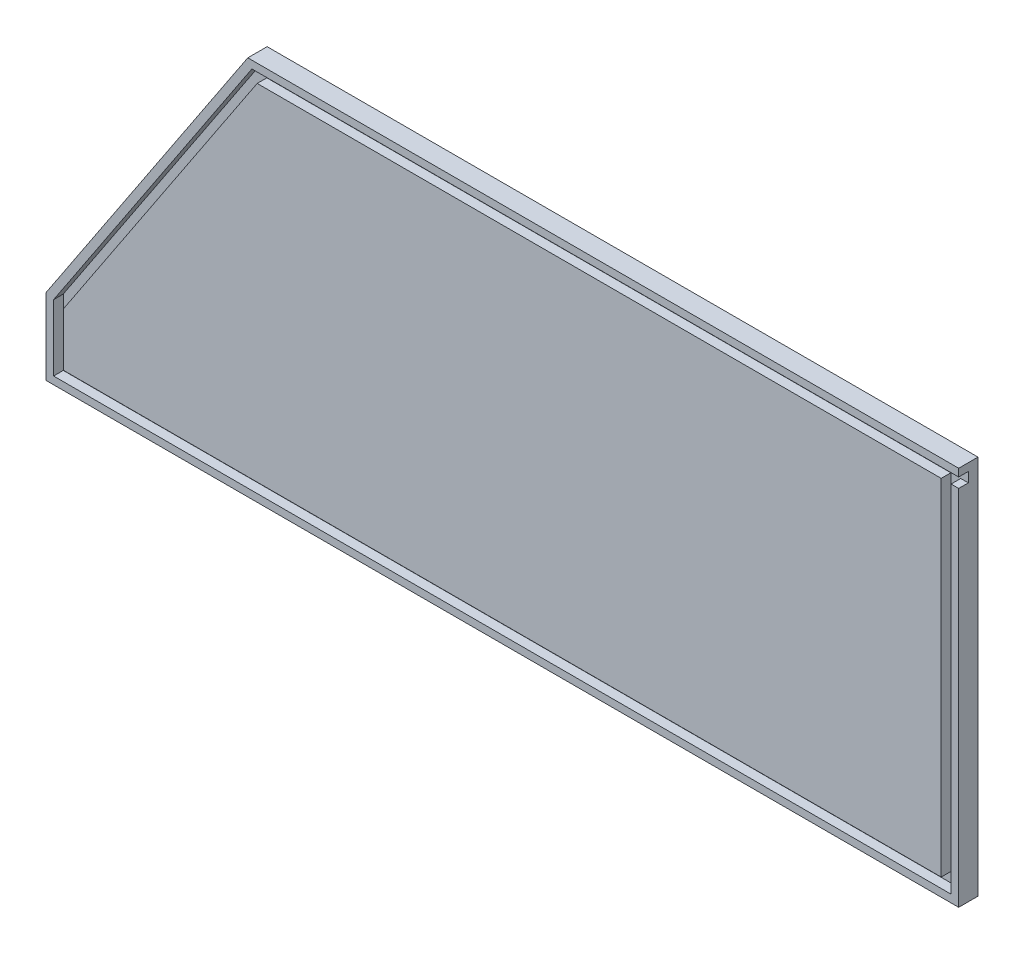
from build123d import *

# Parameters (mm, degrees)
BOSS_EXTRUDE1_DEPTH = 12.7
CUT_EXTRUDE1_DEPTH  = 6.35
SKETCH5_W           = 41.48623644
SKETCH5_H           = 6.5
CUT_EXTRUDE2_DEPTH  = 6.35


with BuildPart() as part:
    # Sketch1 → Boss-Extrude1 (new body)
    with BuildSketch(Plane.XY):
        Polygon((-524.529885057, -25.691954023), (75.470114943, -25.691954023), (75.470114943, 224.308045977), (-391.864893443, 224.308045977), (-524.529885057, 24.308045977), align=None)
    extrude(amount=BOSS_EXTRUDE1_DEPTH)

    # Sketch4 → Cut-Extrude1 (cut)
    with BuildSketch(Plane.XY.offset(12.7)):
        Polygon((-519.529885057, 22.800489254), (-519.529885057, -20.691954023), (70.470114943, -20.691954023), (70.470114943, 219.308045977), (-389.181518234, 219.308045977), align=None)
        Polygon((-513.029885057, 20.840665514), (-513.029885057, -14.191954023), (63.970114943, -14.191954023), (63.970114943, 212.808045977), (-385.693130461, 212.808045977), align=None, mode=Mode.SUBTRACT)
    extrude(amount=-CUT_EXTRUDE1_DEPTH, mode=Mode.SUBTRACT)

    # Sketch5 → Cut-Extrude2 (cut)
    with BuildSketch(Plane.XY.offset(12.7)):
        with Locations((65.370018612, 216.058045977)):
            Rectangle(SKETCH5_W, SKETCH5_H)
    extrude(amount=-CUT_EXTRUDE2_DEPTH, mode=Mode.SUBTRACT)


solid = part.part
